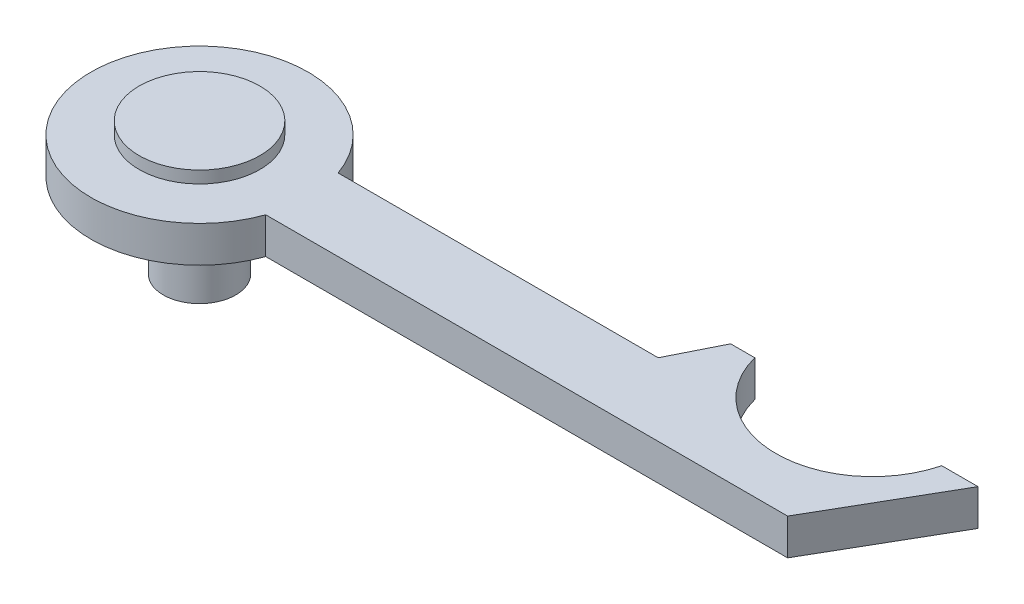
from build123d import *

# Parameters (mm, degrees)
IZIM1_R                     = 9
IZIM1_R_2                   = 3
Y_KSEKLIK_EKSTR_ZYON1_DEPTH = 3
Y_KSEKLIK_EKSTR_ZYON2_START = -3
Y_KSEKLIK_EKSTR_ZYON2_DEPTH = 3


with BuildPart() as part:
    # Çizim1 → Yükseklik-Ekstrüzyon1 (new body)
    with BuildSketch(Plane(origin=(0, 0, 0), x_dir=(1, 0, 0), z_dir=(0, 1, 0))):
        with Locations(Location((0, 0, 0), (0, 0, 270))):
            Circle(IZIM1_R)
        with Locations(Location((0, 0, 0), (0, 0, 270))):
            Circle(IZIM1_R_2, mode=Mode.SUBTRACT)
    extrude(amount=Y_KSEKLIK_EKSTR_ZYON1_DEPTH)

    # Çizim3 → Yükseklik-Ekstrüzyon2 (add)
    with BuildSketch(Plane(origin=(0, 3, 0), x_dir=(1, 0, 0), z_dir=(0, 1, 0)).offset(Y_KSEKLIK_EKSTR_ZYON2_START)):
        with BuildLine():
            Line((8.485281374, 3), (35, 3))
            Line((35, 3), (37, 7))
            Line((37, 7), (39, 7))
            ThreePointArc((39, 7), (46.745966692, 1), (54.491933385, 7))
            Line((54.491933385, 7), (57.491933385, 7))
            Line((57.491933385, 7), (51.718430693, -3))
            Line((51.718430693, -3), (8.485281374, -3))
            ThreePointArc((8.485281374, -3), (9, 0), (8.485281374, 3))
        make_face()
    extrude(amount=Y_KSEKLIK_EKSTR_ZYON2_DEPTH)


with BuildPart() as body_2:
    # Çizim5 → Döndür1 (revolve)
    with BuildSketch(Plane.XY, mode=Mode.PRIVATE) as d_nd_r1_sk:
        Polygon((0, 3), (0, -7), (3, -7), (3, 3), (5, 3), (5, 4), (0, 4), align=None)
    revolve(d_nd_r1_sk.sketch.rotate(Axis((0, 3, 0), (0, -1, 0)), 180), axis=Axis((0, 3, 0), (0, -1, 0)))


solid = Compound([part.part, body_2.part])
